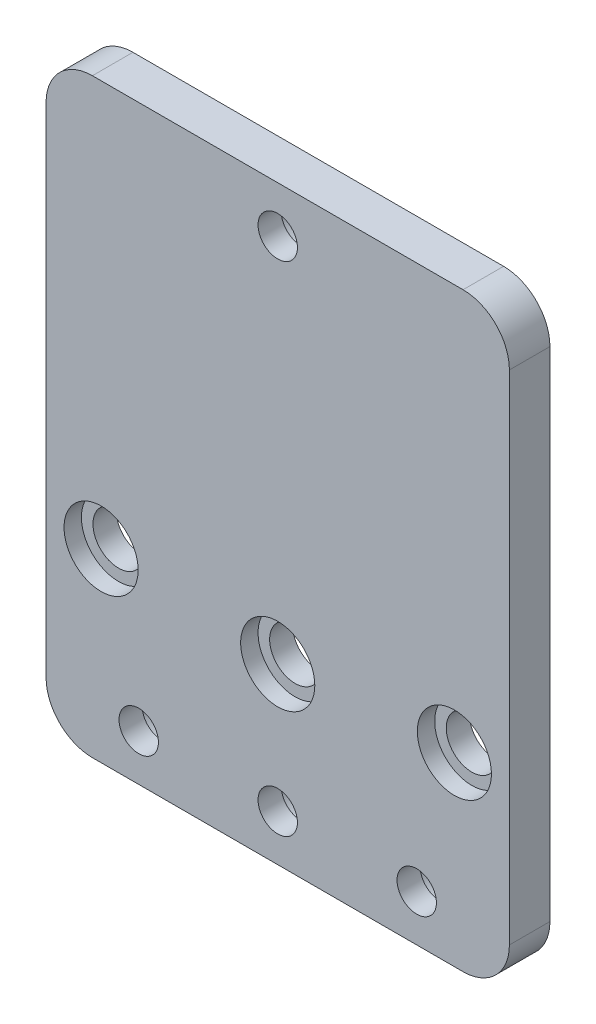
from build123d import *

# Parameters (mm, degrees)
SKETCH_2_R        = 1.7
SKETCH_2_R_2      = 2.2
EXTRUDE_1_DEPTH   = 3.5
SKETCH_3_R        = 2.7
EXTRUDE_2_DEPTH   = 1.5
EXTRUDE_2_2_DEPTH = 1.5
EXTRUDE_2_3_DEPTH = 1.5
EXTRUDE_2_4_DEPTH = 1.5
SKETCH_4_R        = 3.2
EXTRUDE_3_DEPTH   = 1.5
EXTRUDE_3_2_DEPTH = 1.5
EXTRUDE_3_3_DEPTH = 1.5


with BuildPart() as part:
    # 草图2 → 凸台-拉伸1 (new body)
    with BuildSketch(Plane.XY):
        with BuildLine():
            Line((8220.969436472, 3044.354101623), (8252.969436472, 3044.354101623))
            ThreePointArc((8252.969436472, 3044.354101623), (8255.797863597, 3043.182528748), (8256.969436472, 3040.354101623))
            Line((8256.969436472, 3040.354101623), (8256.969436472, 2997.366275847))
            ThreePointArc((8256.969436472, 2997.366275847), (8255.797863597, 2994.537848723), (8252.969436472, 2993.366275847))
            Line((8252.969436472, 2993.366275847), (8220.969436472, 2993.366275847))
            ThreePointArc((8220.969436472, 2993.366275847), (8218.141009348, 2994.537848723), (8216.969436472, 2997.366275847))
            Line((8216.969436472, 2997.366275847), (8216.969436472, 3040.354101623))
            ThreePointArc((8216.969436472, 3040.354101623), (8218.141009348, 3043.182528748), (8220.969436472, 3044.354101623))
        make_face()
        with Locations((8236.969436473, 3040.354101623)):
            Circle(SKETCH_2_R, mode=Mode.SUBTRACT)
        with Locations((8248.969436472, 2997.366275847)):
            Circle(SKETCH_2_R, mode=Mode.SUBTRACT)
        with Locations((8236.969436472, 2997.366275847)):
            Circle(SKETCH_2_R, mode=Mode.SUBTRACT)
        with Locations((8224.969436472, 2997.366275847)):
            Circle(SKETCH_2_R, mode=Mode.SUBTRACT)
        with Locations((8236.969436473, 3008.366275847)):
            Circle(SKETCH_2_R_2, mode=Mode.SUBTRACT)
        with Locations((8221.719436473, 3009.366275847)):
            Circle(SKETCH_2_R_2, mode=Mode.SUBTRACT)
        with Locations((8252.219436473, 3009.366275847)):
            Circle(SKETCH_2_R_2, mode=Mode.SUBTRACT)
    extrude(amount=EXTRUDE_1_DEPTH)


with BuildPart() as body_2:
    # 草图3 → 凸台-拉伸2 (new body)
    with BuildSketch(Plane(origin=(0, 0, 0), x_dir=(-1, 0, 0), z_dir=(0, 0, -1))):
        with Locations((-8236.969436473, 3040.354101623)):
            Circle(SKETCH_3_R)
    extrude(amount=-EXTRUDE_2_DEPTH)


with BuildPart() as body_3:
    # 草图3 → Extrude 2 2 (new body)
    with BuildSketch(Plane(origin=(0, 0, 0), x_dir=(-1, 0, 0), z_dir=(0, 0, -1))):
        with Locations((-8248.969436472, 2997.366275847)):
            Circle(SKETCH_3_R)
    extrude(amount=-EXTRUDE_2_2_DEPTH)


with BuildPart() as body_4:
    # 草图3 → Extrude 2 3 (new body)
    with BuildSketch(Plane(origin=(0, 0, 0), x_dir=(-1, 0, 0), z_dir=(0, 0, -1))):
        with Locations((-8236.969436472, 2997.366275847)):
            Circle(SKETCH_3_R)
    extrude(amount=-EXTRUDE_2_3_DEPTH)


with BuildPart() as body_5:
    # 草图3 → Extrude 2 4 (new body)
    with BuildSketch(Plane(origin=(0, 0, 0), x_dir=(-1, 0, 0), z_dir=(0, 0, -1))):
        with Locations((-8224.969436472, 2997.366275847)):
            Circle(SKETCH_3_R)
    extrude(amount=-EXTRUDE_2_4_DEPTH)


with BuildPart() as body_6:
    # 草图4 → 凸台-拉伸3 (new body)
    with BuildSketch(Plane.XY.offset(3.5)):
        with Locations((8236.969436473, 3008.366275847)):
            Circle(SKETCH_4_R)
    extrude(amount=-EXTRUDE_3_DEPTH)


with BuildPart() as body_7:
    # 草图4 → Extrude 3 2 (new body)
    with BuildSketch(Plane.XY.offset(3.5)):
        with Locations((8221.719436473, 3009.366275847)):
            Circle(SKETCH_4_R)
    extrude(amount=-EXTRUDE_3_2_DEPTH)


with BuildPart() as body_8:
    # 草图4 → Extrude 3 3 (new body)
    with BuildSketch(Plane.XY.offset(3.5)):
        with Locations((8252.219436473, 3009.366275847)):
            Circle(SKETCH_4_R)
    extrude(amount=-EXTRUDE_3_3_DEPTH)


with BuildPart() as part_1:
    add(part.part)

    # Combine 1: cut body 6, body 8, body 7, body 5, body 4, body 3, body 2
    add(body_6.part, mode=Mode.SUBTRACT)
    add(body_8.part, mode=Mode.SUBTRACT)
    add(body_7.part, mode=Mode.SUBTRACT)
    add(body_5.part, mode=Mode.SUBTRACT)
    add(body_4.part, mode=Mode.SUBTRACT)
    add(body_3.part, mode=Mode.SUBTRACT)
    add(body_2.part, mode=Mode.SUBTRACT)


solid = part_1.part
